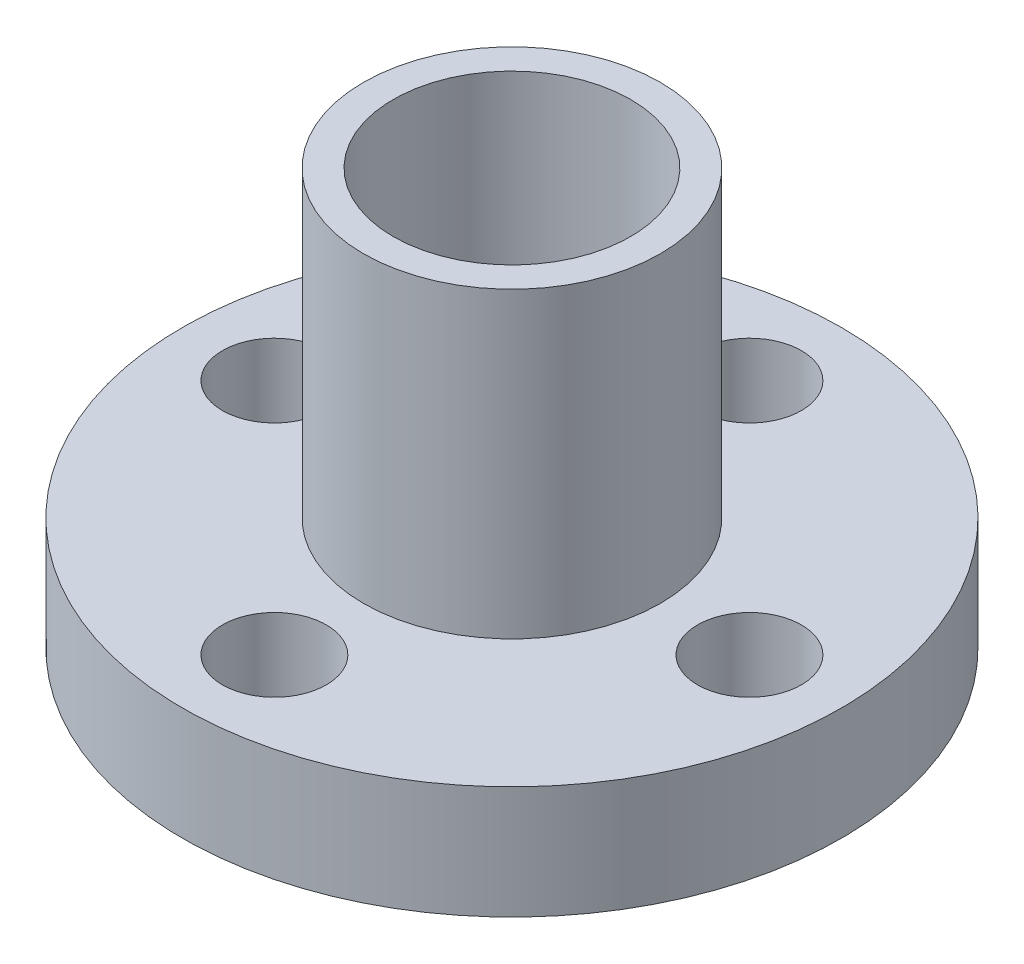
from build123d import *

# Parameters (mm, degrees)
SKETCH1_R                  = 11.1
BOSS_EXTRUDE1_DEPTH        = 3.8
BOSS_EXTRUDE2_START        = -3.8
SKETCH2_R                  = 5
BOSS_EXTRUDE2_DEPTH        = 14
SKETCH3_R                  = 4
CUT_EXTRUDE1_DEPTH         = 22.033782351
SKETCH4_R                  = 5.09
SKETCH4_R_2                = 4
BOSS_EXTRUDE3_DEPTH        = 1.67
F_3_5_3_5_DIAMETER_HOLE1_D = 3.5


with BuildPart() as part:
    # Sketch1 → Boss-Extrude1 (new body)
    with BuildSketch(Plane(origin=(0, 0, 0), x_dir=(1, 0, 0), z_dir=(0, 1, 0))):
        with Locations(Location((0, 0, 0), (0, 0, 90))):
            Circle(SKETCH1_R)
    extrude(amount=BOSS_EXTRUDE1_DEPTH)

    # Sketch2 → Boss-Extrude2 (add)
    with BuildSketch(Plane(origin=(0, 3.8, 0), x_dir=(1, 0, 0), z_dir=(0, 1, 0)).offset(BOSS_EXTRUDE2_START)):
        with Locations(Location((0, 0, 0), (0, 0, 270))):
            Circle(SKETCH2_R)
    extrude(amount=BOSS_EXTRUDE2_DEPTH)

    # Sketch3 → Cut-Extrude1 (cut, through all)
    with BuildSketch(Plane(origin=(0, 14, 0), x_dir=(1, 0, 0), z_dir=(0, 1, 0))):
        with Locations(Location((0, 0, 0), (0, 0, 270))):
            Circle(SKETCH3_R)
    extrude(amount=-CUT_EXTRUDE1_DEPTH, mode=Mode.SUBTRACT)

    # Sketch4 → Boss-Extrude3 (add)
    with BuildSketch(Plane.XZ):
        with Locations(Location((0, 0, 0), (0, 0, 90))):
            Circle(SKETCH4_R)
        with Locations(Location((0, 0, 0), (0, 0, 90))):
            Circle(SKETCH4_R_2, mode=Mode.SUBTRACT)
    extrude(amount=BOSS_EXTRUDE3_DEPTH)

    # Ø3.5 (3.5) Diameter Hole1 (through all)
    with Locations(Plane(origin=(0, 3.8, 0), x_dir=(1, 0, 0), z_dir=(0, 1, 0))):
        with Locations((0, 8), (0, -8), (8, 0), (-8, 0)):
            Hole(F_3_5_3_5_DIAMETER_HOLE1_D / 2)


solid = part.part
